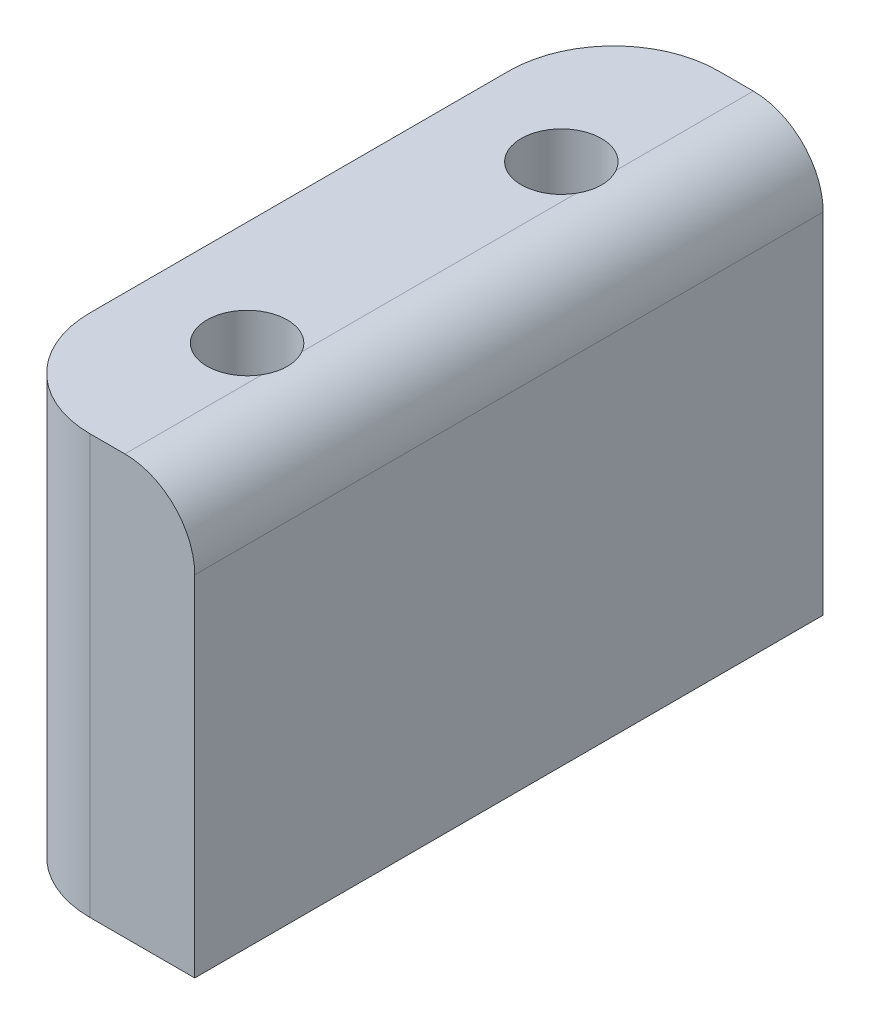
from build123d import *

# Parameters (mm, degrees)
EXTRUDE_1_DEPTH     = 18
SKETCH_2_R          = 1.15
CUT_EXTRUDE_1_DEPTH = 16
FILLET_1_R          = 3


with BuildPart() as part:
    # 草图1 → 凸台-拉伸1 (new body)
    with BuildSketch(Plane.XY):
        with BuildLine():
            Line((6, 0), (0, 0))
            Line((0, 0), (0, 12))
            Line((0, 12), (4, 12))
            ThreePointArc((4, 12), (5.414213562, 11.414213562), (6, 10))
            Line((6, 10), (6, 0))
        make_face()
    extrude(amount=EXTRUDE_1_DEPTH)

    # 草图2 → 切除-拉伸1 (cut)
    with BuildSketch(Plane.XZ):
        with Locations((3, 13.5)):
            Circle(SKETCH_2_R)
        with Locations((3, 4.5)):
            Circle(SKETCH_2_R)
    extrude(amount=-CUT_EXTRUDE_1_DEPTH, mode=Mode.SUBTRACT)

    # 圆角1
    fillet_1_edges = [part.edges().sort_by_distance(p)[0] for p in [
        (0, 6, 18),
        (0, 6, 0),
    ]]
    fillet(fillet_1_edges, radius=FILLET_1_R)


solid = part.part
